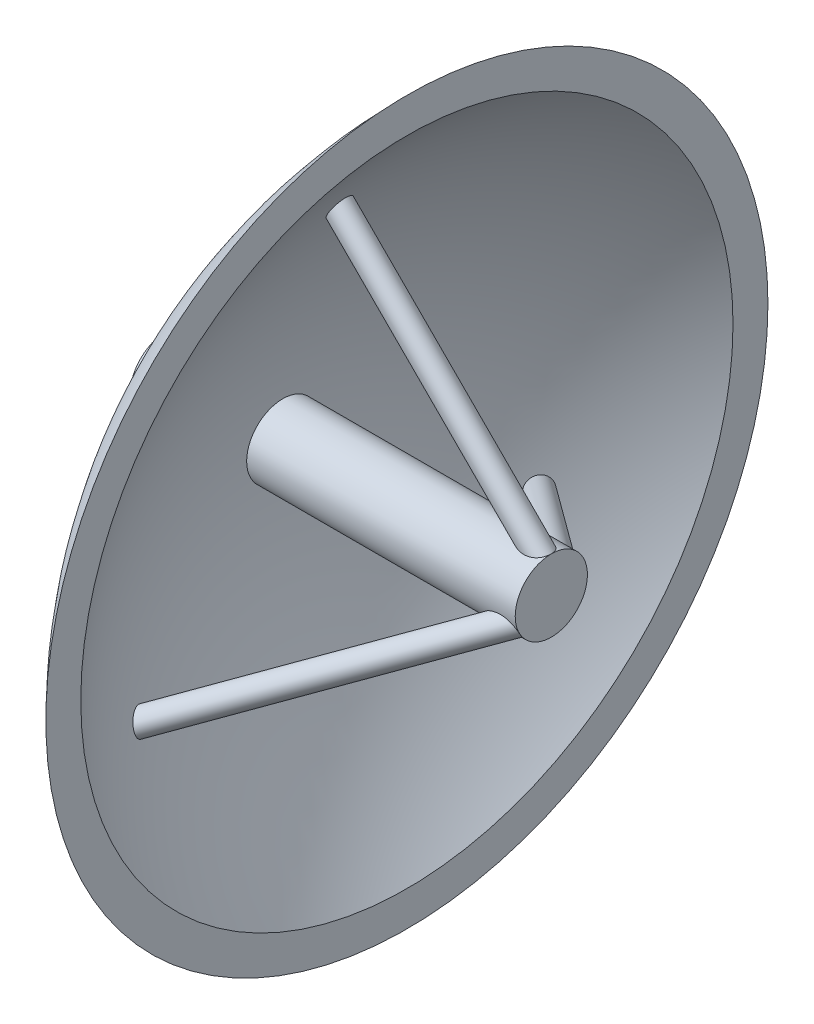
from build123d import *

# Parameters (mm, degrees)
BOSS_EXTRUDE1_DEPTH      = 300
BOSS_EXTRUDE1_DEPTH_BACK = 500
SKETCH2_R                = 75
CIRPATTERN1_COUNT        = 3


with BuildPart() as part:
    # Sketch1 → Revolve1 (revolve)
    with BuildSketch(Plane(origin=(0, 0, 0), x_dir=(1, 0, 0), z_dir=(0, 1, 0))):
        with BuildLine():
            Line((-750, 750), (-750, 677.44666419))
            ThreePointArc((-750, 677.44666419), (-943.246815965, 362.931711199), (-1010.66017178, 0))
            Line((-1010.66017178, 0), (-1060.66017178, 0))
            ThreePointArc((-1060.66017178, 0), (-979.922223657, 405.89707511), (-750, 750))
        make_face()
    revolve(axis=Axis((-1110.59399243, 0, 0), (1, 0, 0)))

    # Sketch2 → Boss-Extrude1 (add, two sides: drawn at the far end of the back side and taken through both)
    with BuildSketch(Plane(origin=(-750, 0, 0), x_dir=(0, 0, -1), z_dir=(1, 0, 0)).offset(-BOSS_EXTRUDE1_DEPTH_BACK)):
        with Locations(Location((0, 0, 0), (0, 0, 180))):
            Circle(SKETCH2_R)
    extrude(amount=BOSS_EXTRUDE1_DEPTH + BOSS_EXTRUDE1_DEPTH_BACK)

    # Sketch5 → Revolve2 (revolve)
    with BuildSketch(Plane.XY):
        Polygon((-450, 75), (-881.052293811, 506.052293811), (-899.012806053, 488.091781569), (-467.960512242, 57.039487758), align=None)
    revolve2 = revolve(axis=Axis((-467.960512242, 57.039487758, 0), (-0.7071067811865465, 0.7071067811865487, 0)))

    # CirPattern1: Revolve2 ×3 about axis
    cirpattern1_axis = Axis((-450, 0, 0), (1, 0, 0))
    for i in range(1, CIRPATTERN1_COUNT):
        add(revolve2.rotate(cirpattern1_axis, i * 360 / CIRPATTERN1_COUNT))


solid = part.part
